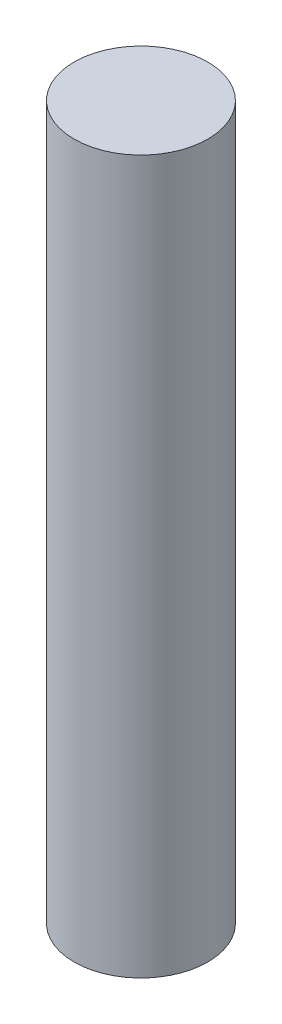
from build123d import *

# Parameters (mm, degrees)
SKETCH1_R           = 2.38125
BOSS_EXTRUDE1_DEPTH = 12.7


with BuildPart() as part:
    # Sketch1 → Boss-Extrude1 (new, symmetric)
    with BuildSketch(Plane(origin=(0, 0, 0), x_dir=(1, 0, 0), z_dir=(0, 1, 0))):
        with Locations(Location((0, 0, 0), (0, 0, 270))):
            Circle(SKETCH1_R)
    extrude(amount=BOSS_EXTRUDE1_DEPTH, both=True)


solid = part.part
